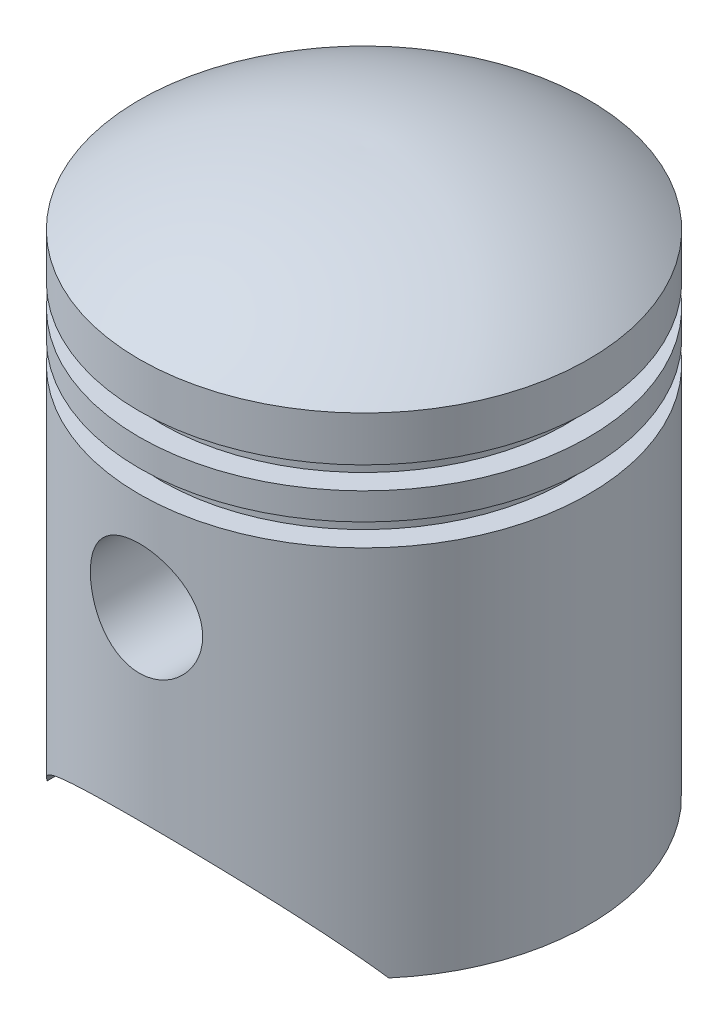
from build123d import *

# Parameters (mm, degrees)
CUT_EXTRUDE1_DEPTH       = 59.745330354
CUT_EXTRUDE1_DEPTH_BACK  = 59.745330354
CUT_EXTRUDE2_DEPTH       = 59.745330416
CUT_EXTRUDE2_DEPTH_BACK  = 59.745330416
SKETCH6_R                = 6.25
BOSS_EXTRUDE1_REACH      = 66.769
BOSS_EXTRUDE1_END_RADIUS = 23
SKETCH8_R                = 7.25
SKETCH8_R_2              = 6.25


with BuildPart() as part:
    # Sketch1 → Revolve1 (revolve)
    with BuildSketch(Plane.XY, mode=Mode.PRIVATE) as revolve1_sk:
        with BuildLine():
            Line((-13.983428571, 26.357142857), (-13.983428571, 24.356505707))
            ThreePointArc((-13.983428571, 24.356505707), (-1.913935934, 22.716308302), (9.016571429, 17.341654002))
            Line((9.016571429, 17.341654002), (9.016571429, 15.357142857))
            Line((9.016571429, 15.357142857), (6.516571429, 15.357142857))
            Line((6.516571429, 15.357142857), (6.516571429, 9.357142857))
            Line((6.516571429, 9.357142857), (6.516571429, 3.357142857))
            Line((6.516571429, 3.357142857), (9.016571429, 3.357142857))
            Line((9.016571429, 3.357142857), (9.016571429, -36.142857143))
            Line((9.016571429, -36.142857143), (11.016571429, -36.142857143))
            Line((11.016571429, -36.142857143), (11.016571429, 5.357142857))
            Line((11.016571429, 5.357142857), (8.516571429, 5.357142857))
            Line((8.516571429, 5.357142857), (8.516571429, 7.857142857))
            Line((8.516571429, 7.857142857), (11.016571429, 7.857142857))
            Line((11.016571429, 7.857142857), (11.016571429, 10.857142857))
            Line((11.016571429, 10.857142857), (8.516571429, 10.857142857))
            Line((8.516571429, 10.857142857), (8.516571429, 13.357142857))
            Line((8.516571429, 13.357142857), (11.016571429, 13.357142857))
            Line((11.016571429, 13.357142857), (11.016571429, 18.357142857))
            ThreePointArc((11.016571429, 18.357142857), (-0.80852688, 24.466210642), (-13.983428571, 26.357142857))
        make_face()
    revolve(revolve1_sk.sketch.rotate(Axis((-13.983428571, 26.357142857, 0), (0, -1, 0)), 90), axis=Axis((-13.983428571, 26.357142857, 0), (0, -1, 0)))

    # Sketch5 → Cut-Extrude1 (cut, two sides: drawn at the far end of the back side and taken through both)
    with BuildSketch(Plane.XY.offset(-CUT_EXTRUDE1_DEPTH_BACK)):
        with BuildLine():
            Line((5.016571429, -36.142857143), (-32.983428571, -36.142857143))
            ThreePointArc((-32.983428571, -36.142857143), (-13.983428571, -26.111638114), (5.016571429, -36.142857143))
        make_face()
    extrude(amount=CUT_EXTRUDE1_DEPTH + CUT_EXTRUDE1_DEPTH_BACK, mode=Mode.SUBTRACT)

    # Sketch6 → Cut-Extrude2 (cut, two sides: drawn at the far end of the back side and taken through both)
    with BuildSketch(Plane.XY.offset(-CUT_EXTRUDE2_DEPTH_BACK)):
        with Locations((-13.983428571, -5.642857143)):
            Circle(SKETCH6_R)
    extrude(amount=CUT_EXTRUDE2_DEPTH + CUT_EXTRUDE2_DEPTH_BACK, mode=Mode.SUBTRACT)

    # Boss-Extrude1: up to this cylinder (the profile starts inside it)
    boss_extrude1_end = Plane(origin=(-13.983428571, -12.687796, 0), z_dir=(0, 1, 0)) * Cylinder(BOSS_EXTRUDE1_END_RADIUS, 180.538, mode=Mode.PRIVATE)
    # Sketch8 → Boss-Extrude1 (add, up to the surface)
    with BuildSketch(Plane.XY.offset(12), mode=Mode.PRIVATE) as boss_extrude1_sk1:
        with Locations(Location((-13.983428571, -5.642857143, 0), (0, 0, 90))):
            Circle(SKETCH8_R)
        with Locations((-13.983428571, -5.642857143)):
            Circle(SKETCH8_R_2, mode=Mode.SUBTRACT)
    boss_extrude1_tool1 = extrude(boss_extrude1_sk1.sketch, amount=BOSS_EXTRUDE1_REACH, mode=Mode.PRIVATE) & boss_extrude1_end
    boss_extrude1 = boss_extrude1_tool1.solids().sort_by_distance((-13.983429, -12.687796, 12))[0]
    add(boss_extrude1)

    # Mirror1: Boss-Extrude1 across plane
    add(boss_extrude1.mirror(Plane.XY))


solid = part.part
